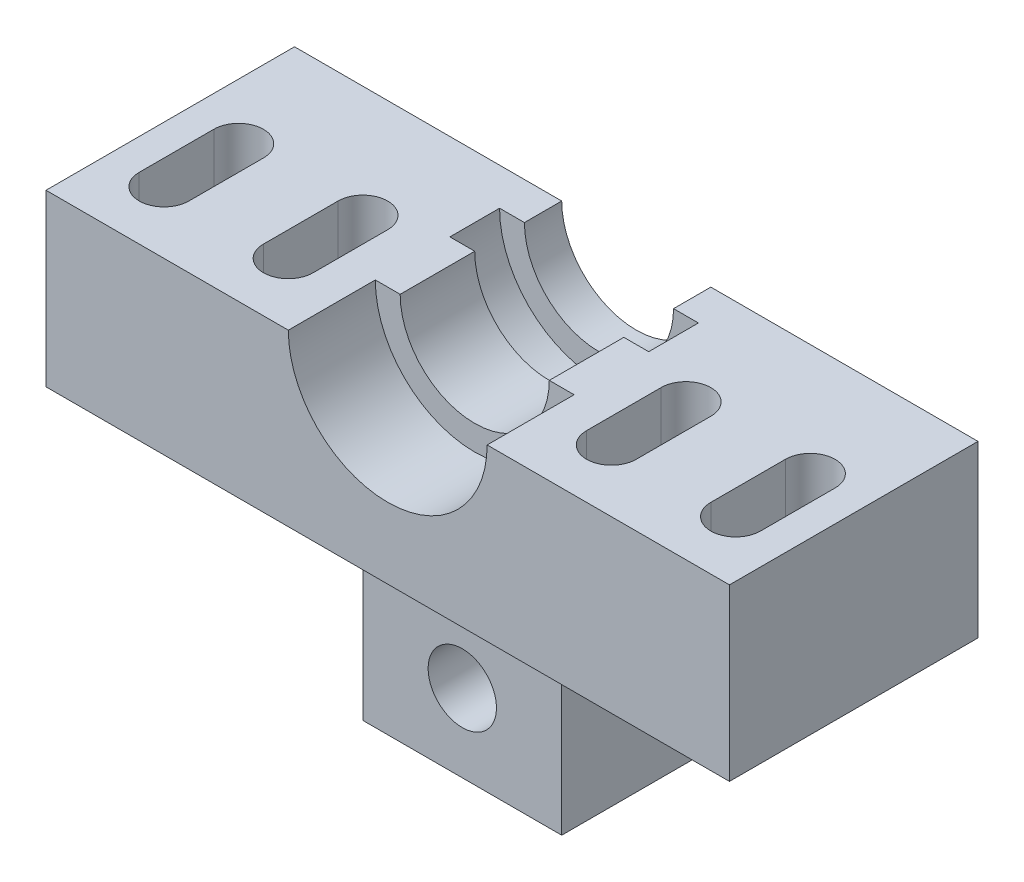
from build123d import *

# Parameters (mm, degrees)
REVOLVE1_ANGLE      = 180
BOSS_EXTRUDE4_START = -20
BOSS_EXTRUDE4_DEPTH = 20
CUT_EXTRUDE4_DEPTH  = 20
SKETCH12_W          = 16
SKETCH12_H          = 12
BOSS_EXTRUDE6_DEPTH = 16.5
SKETCH13_W          = 8
SKETCH13_H          = 4
CUT_EXTRUDE6_DEPTH  = 15
SKETCH14_R          = 2.75
CUT_EXTRUDE7_DEPTH  = 15


with BuildPart() as part:
    # Sketch1 → Revolve1 (revolve)
    with BuildSketch(Plane(origin=(0, 0, 0), x_dir=(1, 0, 0), z_dir=(0, 1, 0))):
        Polygon((0, 0), (0, 7), (-2, 7), (-2, 13), (0, 13), (0, 17), (-2, 17), (-2, 20), (4, 20), (4, 17), (4, 0), align=None)
    revolve(axis=Axis((-8, 0, 0), (0, 0, -1)), revolution_arc=REVOLVE1_ANGLE)

    # Sketch8 → Boss-Extrude4 (add)
    with BuildSketch(Plane(origin=(0, 0, -20), x_dir=(-1, 0, 0), z_dir=(0, 0, -1)).offset(BOSS_EXTRUDE4_START)):
        with BuildLine():
            Line((20, 0), (35.5, 0))
            Line((35.5, 0), (35.5, -13.7))
            Line((35.5, -13.7), (-19.5, -13.7))
            Line((-19.5, -13.7), (-19.5, 0))
            Line((-19.5, 0), (-4, 0))
            ThreePointArc((-4, 0), (8, -12), (20, 0))
        make_face()
    extrude(amount=BOSS_EXTRUDE4_DEPTH)

    # Sketch9 → Cut-Extrude4 (cut)
    with BuildSketch(Plane(origin=(0, 0, 0), x_dir=(1, 0, 0), z_dir=(0, 1, 0))):
        with BuildLine():
            Line((-33, 5), (-33, 11))
            ThreePointArc((-33, 11), (-31, 13), (-29, 11))
            Line((-29, 11), (-29, 5))
            ThreePointArc((-29, 5), (-31, 3), (-33, 5))
        make_face()
        with BuildLine():
            Line((-19, 5), (-19, 11))
            ThreePointArc((-19, 11), (-21, 13), (-23, 11))
            Line((-23, 11), (-23, 5))
            ThreePointArc((-23, 5), (-21, 3), (-19, 5))
        make_face()
        with BuildLine():
            Line((3, 5), (3, 11))
            ThreePointArc((3, 11), (5, 13), (7, 11))
            Line((7, 11), (7, 5))
            ThreePointArc((7, 5), (5, 3), (3, 5))
        make_face()
        with BuildLine():
            Line((17, 5), (17, 11))
            ThreePointArc((17, 11), (15, 13), (13, 11))
            Line((13, 11), (13, 5))
            ThreePointArc((13, 5), (15, 3), (17, 5))
        make_face()
    extrude(amount=-CUT_EXTRUDE4_DEPTH, mode=Mode.SUBTRACT)

    # Sketch12 → Boss-Extrude6 (add)
    with BuildSketch(Plane(origin=(0, -13.7, 0), x_dir=(-1, 0, 0), z_dir=(0, -1, 0))):
        with Locations((8, 12)):
            Rectangle(SKETCH12_W, SKETCH12_H)
    extrude(amount=BOSS_EXTRUDE6_DEPTH)

    # Sketch13 → Cut-Extrude6 (cut)
    with BuildSketch(Plane(origin=(0, -30.2, 0), x_dir=(-1, 0, 0), z_dir=(0, -1, 0))):
        with Locations((8, 12)):
            Rectangle(SKETCH13_W, SKETCH13_H)
    extrude(amount=-CUT_EXTRUDE6_DEPTH, mode=Mode.SUBTRACT)

    # Sketch14 → Cut-Extrude7 (cut)
    with BuildSketch(Plane(origin=(0, 0, -18), x_dir=(-1, 0, 0), z_dir=(0, 0, -1))):
        with Locations((8, -23.95)):
            Circle(SKETCH14_R)
    extrude(amount=-CUT_EXTRUDE7_DEPTH, mode=Mode.SUBTRACT)


solid = part.part
